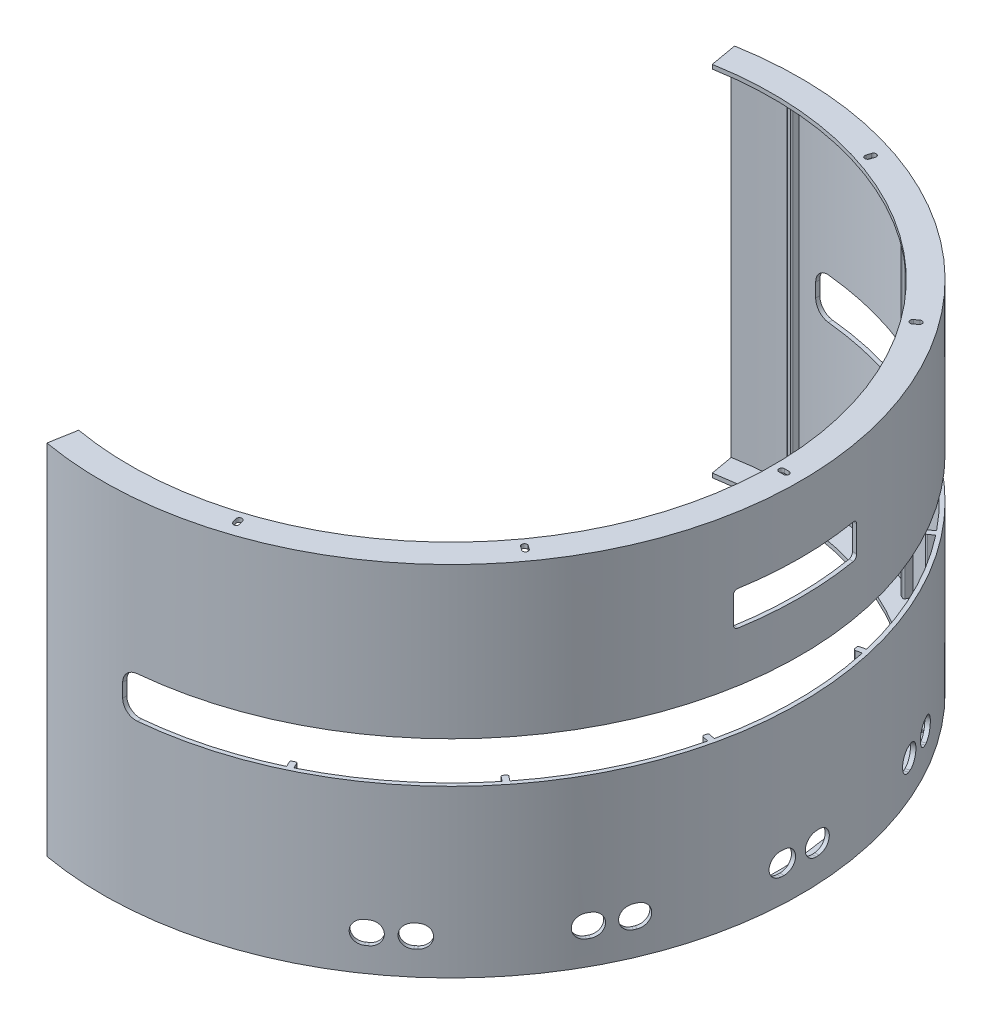
from build123d import *

# Parameters (mm, degrees)
BOSS_EXTRUDE1_DEPTH   = 255
BOSS_EXTRUDE2_DEPTH   = 255
BOSS_EXTRUDE2_2_DEPTH = 255
BOSS_EXTRUDE2_3_DEPTH = 255
BOSS_EXTRUDE2_4_DEPTH = 255
BOSS_EXTRUDE2_5_DEPTH = 255
BOSS_EXTRUDE2_6_DEPTH = 255
BOSS_EXTRUDE2_7_DEPTH = 255
BOSS_EXTRUDE2_8_DEPTH = 255
SKETCH4_W             = 480
SKETCH4_H             = 30
CUT_EXTRUDE2_DEPTH    = 476.5
FILLET2_R             = 10
BOSS_EXTRUDE3_DEPTH   = 3
CUT_EXTRUDE3_DEPTH    = 5
LPATTERN1_COUNT       = 2
LPATTERN1_PITCH       = 258
LPATTERN2_COUNT       = 2
LPATTERN2_PITCH       = 258
SKETCH9_W             = 27.100731328
SKETCH9_H             = 25
CUT_EXTRUDE4_DEPTH    = 45
FILLET3_R             = 3
CUT_EXTRUDE5_DEPTH    = 600
CIRPATTERN1_COUNT     = 3
CIRPATTERN1_ANGLE     = 52
CIRPATTERN2_COUNT     = 3
CIRPATTERN2_ANGLE     = 52


with BuildPart() as part:
    # Sketch3 → Boss-Extrude1 (new body)
    with BuildSketch(Plane(origin=(0, 0, 0), x_dir=(1, 0, 0), z_dir=(0, 1, 0))):
        with BuildLine():
            ThreePointArc((0, -254.5), (-22.181136529, -253.531550664), (-44.193461216, -250.633573142))
            Line((-44.193461216, -250.633573142), (-43.672516683, -247.679149883))
            ThreePointArc((-43.672516683, -247.679149883), (-21.919669301, -250.54296657), (0, -251.5))
            ThreePointArc((0, -251.5), (251.5, 0), (0, 251.5))
            ThreePointArc((0, 251.5), (-21.919669301, 250.54296657), (-43.672516683, 247.679149883))
            Line((-43.672516683, 247.679149883), (-44.193461216, 250.633573142))
            ThreePointArc((-44.193461216, 250.633573142), (-22.181136529, 253.531550664), (0, 254.5))
            ThreePointArc((0, 254.5), (254.5, 0), (0, -254.5))
        make_face()
    extrude(amount=BOSS_EXTRUDE1_DEPTH)


with BuildPart() as body_2:
    # Sketch6 → Boss-Extrude2 (new body)
    with BuildSketch(Plane(origin=(0, 255, 0), x_dir=(1, 0, 0), z_dir=(0, 1, 0))):
        with BuildLine():
            Line((-2, -253.081926056), (2, -253.081926056))
            Line((2, -253.081926056), (2, -247.081926056))
            ThreePointArc((2, -247.081926056), (1.707106781, -246.374819275), (1, -246.081926056))
            Line((1, -246.081926056), (-1, -246.081926056))
            ThreePointArc((-1, -246.081926056), (-1.707106781, -246.374819275), (-2, -247.081926056))
            Line((-2, -247.081926056), (-2, -253.081926056))
        make_face()
    extrude(amount=-BOSS_EXTRUDE2_DEPTH)


with BuildPart() as body_3:
    # Sketch6 → Boss-Extrude2 2 (new body)
    with BuildSketch(Plane(origin=(0, 255, 0), x_dir=(1, 0, 0), z_dir=(0, 1, 0))):
        with BuildLine():
            Line((-1, 246.081926056), (1, 246.081926056))
            ThreePointArc((1, 246.081926056), (1.707106781, 246.374819275), (2, 247.081926056))
            Line((2, 247.081926056), (2, 253.081926056))
            Line((2, 253.081926056), (-2, 253.081926056))
            Line((-2, 253.081926056), (-2, 247.081926056))
            ThreePointArc((-2, 247.081926056), (-1.707106781, 246.374819275), (-1, 246.081926056))
        make_face()
    extrude(amount=-BOSS_EXTRUDE2_2_DEPTH)


with BuildPart() as body_4:
    # Sketch6 → Boss-Extrude2 3 (new body)
    with BuildSketch(Plane(origin=(0, 255, 0), x_dir=(1, 0, 0), z_dir=(0, 1, 0))):
        with BuildLine():
            Line((111.610070116, 227.151168927), (108.006194645, 228.886703884))
            Line((108.006194645, 228.886703884), (105.40289221, 223.480890676))
            ThreePointArc((105.40289221, 223.480890676), (105.359977747, 222.716727875), (105.869977339, 222.146038069))
            Line((105.869977339, 222.146038069), (107.671915074, 221.278270591))
            ThreePointArc((107.671915074, 221.278270591), (108.436077876, 221.235356129), (109.006767681, 221.74535572))
            Line((109.006767681, 221.74535572), (111.610070116, 227.151168927))
        make_face()
    extrude(amount=-BOSS_EXTRUDE2_3_DEPTH)


with BuildPart() as body_5:
    # Sketch6 → Boss-Extrude2 4 (new body)
    with BuildSketch(Plane(origin=(0, 255, 0), x_dir=(1, 0, 0), z_dir=(0, 1, 0))):
        with BuildLine():
            Line((199.114397038, 156.230336966), (196.620437831, 159.357662896))
            Line((196.620437831, 159.357662896), (191.929448936, 155.616724085))
            ThreePointArc((191.929448936, 155.616724085), (191.559226528, 154.946857078), (191.771107255, 154.2114028))
            Line((191.771107255, 154.2114028), (193.018086859, 152.647739835))
            ThreePointArc((193.018086859, 152.647739835), (193.687953865, 152.277517427), (194.423408143, 152.489398155))
            Line((194.423408143, 152.489398155), (199.114397038, 156.230336966))
        make_face()
    extrude(amount=-BOSS_EXTRUDE2_4_DEPTH)


with BuildPart() as body_6:
    # Sketch6 → Boss-Extrude2 5 (new body)
    with BuildSketch(Plane(origin=(0, 255, 0), x_dir=(1, 0, 0), z_dir=(0, 1, 0))):
        with BuildLine():
            Line((247.181675649, 54.366170729), (246.291591913, 58.265882378))
            Line((246.291591913, 58.265882378), (240.44202444, 56.930756774))
            ThreePointArc((240.44202444, 56.930756774), (239.817821175, 56.487860938), (239.689617462, 55.733307928))
            Line((239.689617462, 55.733307928), (240.13465933, 53.783452104))
            ThreePointArc((240.13465933, 53.783452104), (240.577555165, 53.159248838), (241.332108176, 53.031045125))
            Line((241.332108176, 53.031045125), (247.181675649, 54.366170729))
        make_face()
    extrude(amount=-BOSS_EXTRUDE2_5_DEPTH)


with BuildPart() as body_7:
    # Sketch6 → Boss-Extrude2 6 (new body)
    with BuildSketch(Plane(origin=(0, 255, 0), x_dir=(1, 0, 0), z_dir=(0, 1, 0))):
        with BuildLine():
            Line((246.291591913, -58.265882378), (247.181675649, -54.366170729))
            Line((247.181675649, -54.366170729), (241.332108176, -53.031045125))
            ThreePointArc((241.332108176, -53.031045125), (240.577555165, -53.159248838), (240.13465933, -53.783452104))
            Line((240.13465933, -53.783452104), (239.689617462, -55.733307928))
            ThreePointArc((239.689617462, -55.733307928), (239.817821175, -56.487860938), (240.44202444, -56.930756774))
            Line((240.44202444, -56.930756774), (246.291591913, -58.265882378))
        make_face()
    extrude(amount=-BOSS_EXTRUDE2_6_DEPTH)


with BuildPart() as body_8:
    # Sketch6 → Boss-Extrude2 7 (new body)
    with BuildSketch(Plane(origin=(0, 255, 0), x_dir=(1, 0, 0), z_dir=(0, 1, 0))):
        with BuildLine():
            Line((196.620437831, -159.357662896), (199.114397038, -156.230336966))
            Line((199.114397038, -156.230336966), (194.423408143, -152.489398155))
            ThreePointArc((194.423408143, -152.489398155), (193.687953865, -152.277517427), (193.018086859, -152.647739835))
            Line((193.018086859, -152.647739835), (191.771107255, -154.2114028))
            ThreePointArc((191.771107255, -154.2114028), (191.559226528, -154.946857078), (191.929448936, -155.616724085))
            Line((191.929448936, -155.616724085), (196.620437831, -159.357662896))
        make_face()
    extrude(amount=-BOSS_EXTRUDE2_7_DEPTH)


with BuildPart() as body_9:
    # Sketch6 → Boss-Extrude2 8 (new body)
    with BuildSketch(Plane(origin=(0, 255, 0), x_dir=(1, 0, 0), z_dir=(0, 1, 0))):
        with BuildLine():
            Line((108.006194645, -228.886703884), (111.610070116, -227.151168927))
            Line((111.610070116, -227.151168927), (109.006767681, -221.74535572))
            ThreePointArc((109.006767681, -221.74535572), (108.436077876, -221.235356129), (107.671915074, -221.278270591))
            Line((107.671915074, -221.278270591), (105.869977339, -222.146038069))
            ThreePointArc((105.869977339, -222.146038069), (105.359977747, -222.716727875), (105.40289221, -223.480890676))
            Line((105.40289221, -223.480890676), (108.006194645, -228.886703884))
        make_face()
    extrude(amount=-BOSS_EXTRUDE2_8_DEPTH)


with BuildPart() as body_3_1:
    add(body_3.part)

    # Combine2: union part, body 4, body 5, body 6, body 7, body 8, body 9, body 2
    add(part.part)
    add(body_4.part)
    add(body_5.part)
    add(body_6.part)
    add(body_7.part)
    add(body_8.part)
    add(body_9.part)
    add(body_2.part)

    # Sketch4 → Cut-Extrude2 (cut, symmetric)
    with BuildSketch(Plane.XY):
        with Locations((254.5, 133)):
            Rectangle(SKETCH4_W, SKETCH4_H)
    extrude(amount=CUT_EXTRUDE2_DEPTH, both=True, mode=Mode.SUBTRACT)

    # Fillet2
    fillet2_edges = [body_3_1.edges().sort_by_distance(p)[0] for p in [
        (14.5, 118, -252.584129717),
        (14.5, 118, 252.584129717),
        (14.5, 148, -252.584129717),
        (14.5, 148, 252.584129717),
    ]]
    fillet(fillet2_edges, radius=FILLET2_R)

    # Sketch7 → Boss-Extrude3 (add)
    with BuildSketch(Plane(origin=(0, 255, 0), x_dir=(1, 0, 0), z_dir=(0, 1, 0))):
        with BuildLine():
            ThreePointArc((-44.193461216, 250.633573142), (254.5, 0), (-44.193461216, -250.633573142))
            Line((-44.193461216, -250.633573142), (-40.720497663, -230.937418081))
            ThreePointArc((-40.720497663, -230.937418081), (234.5, 0), (-40.720497663, 230.937418081))
            Line((-40.720497663, 230.937418081), (-44.193461216, 250.633573142))
        make_face()
    boss_extrude3 = extrude(amount=BOSS_EXTRUDE3_DEPTH)

    # Sketch8 → Cut-Extrude3 (cut)
    with BuildSketch(Plane.XZ.offset(-255)):
        with BuildLine():
            Line((240.8, 2), (244.2, 2))
            ThreePointArc((244.2, 2), (246.2, 0), (244.2, -2))
            Line((244.2, -2), (240.8, -2))
            ThreePointArc((240.8, -2), (238.8, 0), (240.8, 2))
        make_face()
        with BuildLine():
            Line((195.98686275, -139.920654763), (198.737520531, -141.919124621))
            ThreePointArc((198.737520531, -141.919124621), (199.179984015, -144.712729114), (196.386379522, -145.155192599))
            Line((196.386379522, -145.155192599), (193.635721741, -143.156722741))
            ThreePointArc((193.635721741, -143.156722741), (193.193258257, -140.363118247), (195.98686275, -139.920654763))
        make_face()
        with BuildLine():
            Line((76.313405278, -228.396375135), (77.364063059, -231.629967291))
            ThreePointArc((77.364063059, -231.629967291), (76.079984015, -234.150114312), (73.559836994, -232.866035268))
            Line((73.559836994, -232.866035268), (72.509179213, -229.632443113))
            ThreePointArc((72.509179213, -229.632443113), (73.793258257, -227.112296091), (76.313405278, -228.396375135))
        make_face()
        with BuildLine():
            Line((-72.509179213, -229.632443113), (-73.559836994, -232.866035268))
            ThreePointArc((-73.559836994, -232.866035268), (-76.079984015, -234.150114312), (-77.364063059, -231.629967291))
            Line((-77.364063059, -231.629967291), (-76.313405278, -228.396375135))
            ThreePointArc((-76.313405278, -228.396375135), (-73.793258257, -227.112296091), (-72.509179213, -229.632443113))
        make_face()
        with BuildLine():
            Line((-193.635721741, -143.156722741), (-196.386379522, -145.155192599))
            ThreePointArc((-196.386379522, -145.155192599), (-199.179984015, -144.712729114), (-198.737520531, -141.919124621))
            Line((-198.737520531, -141.919124621), (-195.98686275, -139.920654763))
            ThreePointArc((-195.98686275, -139.920654763), (-193.193258257, -140.363118247), (-193.635721741, -143.156722741))
        make_face()
        with BuildLine():
            Line((-240.8, -2), (-244.2, -2))
            ThreePointArc((-244.2, -2), (-246.2, 0), (-244.2, 2))
            Line((-244.2, 2), (-240.8, 2))
            ThreePointArc((-240.8, 2), (-238.8, 0), (-240.8, -2))
        make_face()
        with BuildLine():
            Line((-195.98686275, 139.920654763), (-198.737520531, 141.919124621))
            ThreePointArc((-198.737520531, 141.919124621), (-199.179984015, 144.712729114), (-196.386379522, 145.155192599))
            Line((-196.386379522, 145.155192599), (-193.635721741, 143.156722741))
            ThreePointArc((-193.635721741, 143.156722741), (-193.193258257, 140.363118247), (-195.98686275, 139.920654763))
        make_face()
        with BuildLine():
            Line((-76.313405278, 228.396375135), (-77.364063059, 231.629967291))
            ThreePointArc((-77.364063059, 231.629967291), (-76.079984015, 234.150114312), (-73.559836994, 232.866035268))
            Line((-73.559836994, 232.866035268), (-72.509179213, 229.632443113))
            ThreePointArc((-72.509179213, 229.632443113), (-73.793258257, 227.112296091), (-76.313405278, 228.396375135))
        make_face()
        with BuildLine():
            Line((72.509179213, 229.632443113), (73.559836994, 232.866035268))
            ThreePointArc((73.559836994, 232.866035268), (76.079984015, 234.150114312), (77.364063059, 231.629967291))
            Line((77.364063059, 231.629967291), (76.313405278, 228.396375135))
            ThreePointArc((76.313405278, 228.396375135), (73.793258257, 227.112296091), (72.509179213, 229.632443113))
        make_face()
        with BuildLine():
            Line((193.635721741, 143.156722741), (196.386379522, 145.155192599))
            ThreePointArc((196.386379522, 145.155192599), (199.179984015, 144.712729114), (198.737520531, 141.919124621))
            Line((198.737520531, 141.919124621), (195.98686275, 139.920654763))
            ThreePointArc((195.98686275, 139.920654763), (193.193258257, 140.363118247), (193.635721741, 143.156722741))
        make_face()
    cut_extrude3 = extrude(amount=-CUT_EXTRUDE3_DEPTH, mode=Mode.SUBTRACT)

    # LPattern1: Boss-Extrude3 ×2
    with Locations(*[(0, -i * LPATTERN1_PITCH, 0) for i in range(1, LPATTERN1_COUNT)]):
        add(boss_extrude3)

    # LPattern2: Cut-Extrude3 ×2
    with Locations(*[(0, -i * LPATTERN2_PITCH, 0) for i in range(1, LPATTERN2_COUNT)]):
        add(cut_extrude3, mode=Mode.SUBTRACT)

    # Sketch9 → Cut-Extrude4 (cut, symmetric)
    with BuildSketch(Plane.XY):
        with Locations((254.5, 197)):
            Rectangle(SKETCH9_W, SKETCH9_H)
    extrude(amount=CUT_EXTRUDE4_DEPTH, both=True, mode=Mode.SUBTRACT)

    # Fillet3
    fillet3_edges = [body_3_1.edges().sort_by_distance(p)[0] for p in [
        (248.965713484, 209.5, -45),
        (248.965713484, 184.5, -45),
        (248.965713484, 184.5, 45),
        (248.965713484, 209.5, 45),
    ]]
    fillet(fillet3_edges, radius=FILLET3_R)

    # Sketch10 → Cut-Extrude5 (cut)
    with BuildSketch(Plane(origin=(0, 0, 0), x_dir=(0, 0, -1), z_dir=(1, 0, 0))):
        with BuildLine():
            Line((13.75, 14.8), (11.75, 14.8))
            ThreePointArc((11.75, 14.8), (3.55, 23), (11.75, 31.2))
            Line((11.75, 31.2), (13.75, 31.2))
            ThreePointArc((13.75, 31.2), (21.95, 23), (13.75, 14.8))
        make_face()
        with BuildLine():
            Line((-13.75, 14.8), (-11.75, 14.8))
            ThreePointArc((-11.75, 14.8), (-3.55, 23), (-11.75, 31.2))
            Line((-11.75, 31.2), (-13.75, 31.2))
            ThreePointArc((-13.75, 31.2), (-21.95, 23), (-13.75, 14.8))
        make_face()
    cut_extrude5 = extrude(amount=CUT_EXTRUDE5_DEPTH, mode=Mode.SUBTRACT)

    # CirPattern1: Cut-Extrude5 ×3 about axis
    cirpattern1_axis = Axis((0, 255, 0), (0, 1, 0))
    for i in range(1, CIRPATTERN1_COUNT):
        add(cut_extrude5.rotate(cirpattern1_axis, i * CIRPATTERN1_ANGLE / (CIRPATTERN1_COUNT - 1)), mode=Mode.SUBTRACT)

    # CirPattern2: Cut-Extrude5 ×3 about axis
    cirpattern2_axis = Axis((0, 255, 0), (0, -1, 0))
    for i in range(1, CIRPATTERN2_COUNT):
        add(cut_extrude5.rotate(cirpattern2_axis, i * CIRPATTERN2_ANGLE / (CIRPATTERN2_COUNT - 1)), mode=Mode.SUBTRACT)


solid = body_3_1.part
